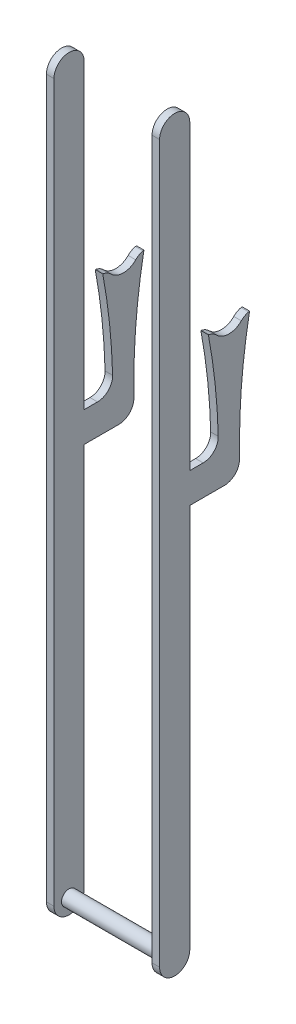
from build123d import *

# Parameters (mm, degrees)
SKETCH_1_W        = 10
SKETCH_1_H        = 40
EXTRUDE_1_DEPTH   = 950
EXTRUDE_1_2_DEPTH = 950
SKETCH_2_R        = 10
EXTRUDE_2_DEPTH   = 150
SKETCH_3_R        = 20
EXTRUDE_3_DEPTH   = 10
EXTRUDE_START     = -10
SKETCH_4_R        = 20
EXTRUDE_4_DEPTH   = 10
EXTRUDE_5_DEPTH   = 10
EXTRUDE_6_DEPTH   = 10
FILLET_1_R        = 20


with BuildPart() as part:
    # 草图1 → 凸台-拉伸1 (new body)
    with BuildSketch(Plane(origin=(0, 0, 0), x_dir=(1, 0, 0), z_dir=(0, 1, 0))):
        with Locations((-70, 0)):
            Rectangle(SKETCH_1_W, SKETCH_1_H)
    extrude(amount=EXTRUDE_1_DEPTH)



with BuildPart() as body_2:
    # 草图1 → Extrude 1 2 (new body)
    with BuildSketch(Plane(origin=(0, 0, 0), x_dir=(1, 0, 0), z_dir=(0, 1, 0))):
        with Locations((70, 0)):
            Rectangle(SKETCH_1_W, SKETCH_1_H)
    extrude(amount=EXTRUDE_1_2_DEPTH)


with BuildPart() as part_1:
    add(part.part)

    add(body_2.part)  # 凸台-拉伸2 merges body 2
    # 草图2 → 凸台-拉伸2 (add)
    with BuildSketch(Plane(origin=(75, 0, 0), x_dir=(0, 0, -1), z_dir=(1, 0, 0))):
        Circle(SKETCH_2_R)
    extrude(amount=-EXTRUDE_2_DEPTH)

    # 草图3 → 凸台-拉伸3 (add)
    with BuildSketch(Plane(origin=(75, 0, 0), x_dir=(0, 0, -1), z_dir=(1, 0, 0))):
        with Locations((0, 950)):
            Circle(SKETCH_3_R)
        Circle(SKETCH_3_R)
    extrude(amount=-EXTRUDE_3_DEPTH)

    # 草图4 → 凸台-拉伸4 (add)
    with BuildSketch(Plane.ZY.offset(75).offset(EXTRUDE_START)):
        with Locations((0, 950)):
            Circle(SKETCH_4_R)
        Circle(SKETCH_4_R)
    extrude(amount=EXTRUDE_4_DEPTH)

    # 草图5 → 凸台-拉伸5 (add)
    with BuildSketch(Plane.ZY.offset(75)):
        with BuildLine():
            Line((-1.961717338, 550), (-58.000349557, 550))
            ThreePointArc((-58.000349557, 550), (-54.659475196, 622.066890367), (-44.665509494, 693.515604688))
            Line((-44.665509494, 693.515604688), (-52.51833449, 691.655753978))
            ThreePointArc((-52.51833449, 691.655753978), (-71.961717338, 680.941793153), (-91.405100186, 691.655753978))
            Line((-91.405100186, 691.655753978), (-99.257925182, 693.515604688))
            ThreePointArc((-99.257925182, 693.515604688), (-89.26395948, 622.066890367), (-85.923085118, 550))
            Line((-85.923085118, 550), (-85.923085118, 510))
            Line((-85.923085118, 510), (-1.961717338, 510))
            Line((-1.961717338, 510), (-1.961717338, 550))
        make_face()
    extrude(amount=-EXTRUDE_5_DEPTH)

    # 草图6 → 凸台-拉伸6 (add)
    with BuildSketch(Plane.ZY.offset(-65)):
        with BuildLine():
            Line((-1.961717338, 550), (-58.000349557, 550))
            ThreePointArc((-58.000349557, 550), (-54.659475196, 622.066890367), (-44.665509494, 693.515604688))
            Line((-44.665509494, 693.515604688), (-52.51833449, 691.655753978))
            ThreePointArc((-52.51833449, 691.655753978), (-71.961717338, 680.941793153), (-91.405100186, 691.655753978))
            Line((-91.405100186, 691.655753978), (-99.257925182, 693.515604688))
            ThreePointArc((-99.257925182, 693.515604688), (-89.26395948, 622.066890367), (-85.923085118, 550))
            Line((-85.923085118, 550), (-85.923085118, 510))
            Line((-85.923085118, 510), (-1.961717338, 510))
            Line((-1.961717338, 510), (-1.961717338, 550))
        make_face()
    extrude(amount=-EXTRUDE_6_DEPTH)

    # 圆角1
    fillet_1_edges = [part_1.edges().sort_by_distance(p)[0] for p in [
        (70, 550, -58.000349557),
        (70, 510, -85.923085118),
        (70, 691.655753978, -91.405100186),
        (70, 691.655753978, -52.51833449),
        (-70, 550, -58.000349557),
        (-70, 510, -85.923085118),
        (-70, 691.655753978, -91.405100186),
        (-70, 691.655753978, -52.51833449),
    ]]
    fillet(fillet_1_edges, radius=FILLET_1_R)


solid = part_1.part
